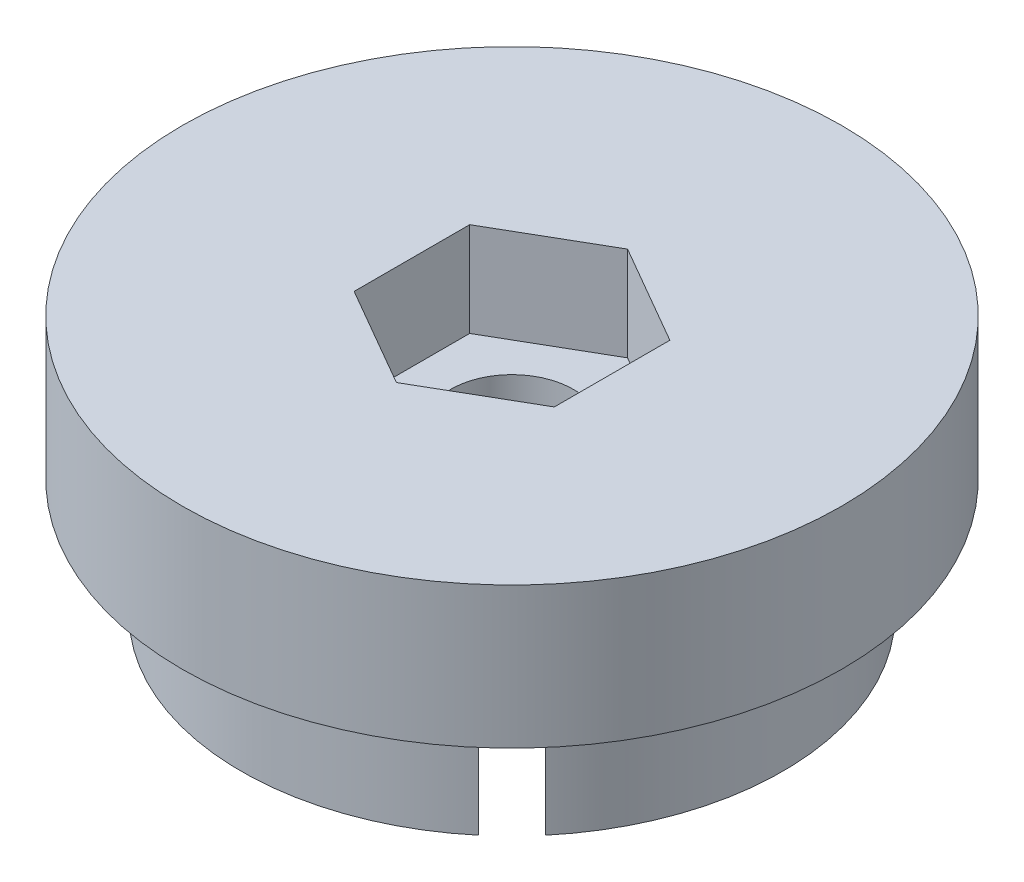
from build123d import *

# Parameters (mm, degrees)
SKETCH3_W           = 6
SKETCH3_H           = 6
SKETCH3_R           = 2.6
BASE_DEPTH          = 5
BLOC_START          = 6
SKETCH8_R           = 14
SKETCH8_R_2         = 2.6
BLOC_DEPTH          = 6
NUT_PLACE_DEPTH     = 4
REINFORCEMENT_DEPTH = 5


with BuildPart() as part:
    # Sketch3 → Base (new body)
    with BuildSketch(Plane(origin=(0, 0, 0), x_dir=(1, 0, 0), z_dir=(0, 1, 0))):
        Rectangle(SKETCH3_W, SKETCH3_H)
        with Locations(Location((0, 0, 0), (0, 0, 270))):
            Circle(SKETCH3_R, mode=Mode.SUBTRACT)
    extrude(amount=-BASE_DEPTH)

    # Sketch8 → Bloc (add)
    with BuildSketch(Plane(origin=(0, 0, 0), x_dir=(1, 0, 0), z_dir=(0, 1, 0)).offset(BLOC_START)):
        with Locations(Location((0, 0, 0), (0, 0, 270))):
            Circle(SKETCH8_R)
        with Locations(Location((0, 0, 0), (0, 0, 270))):
            Circle(SKETCH8_R_2, mode=Mode.SUBTRACT)
    extrude(amount=-BLOC_DEPTH)

    # Sketch4 → Nut_place (cut)
    with BuildSketch(Plane(origin=(0, 6, 0), x_dir=(1, 0, 0), z_dir=(0, 1, 0))):
        Polygon((0, 4.907477288), (-4.25, 2.453738644), (-4.25, -2.453738644), (0, -4.907477288), (4.25, -2.453738644), (4.25, 2.453738644), align=None)
    extrude(amount=-NUT_PLACE_DEPTH, mode=Mode.SUBTRACT)

    # Sketch9 → Reinforcement (add)
    with BuildSketch(Plane.XZ):
        with BuildLine():
            ThreePointArc((11.5, 0), (10.806071801, 3.934312168), (8.808032654, 7.393819092))
            Line((8.808032654, 7.393819092), (5.539213562, 4.125))
            Line((5.539213562, 4.125), (5.539213562, -4.125))
            Line((5.539213562, -4.125), (8.808032654, -7.393819092))
            ThreePointArc((8.808032654, -7.393819092), (10.806071801, -3.934312168), (11.5, 0))
        make_face()
        with BuildLine():
            Line((-4.125, -5.539213562), (-7.393819092, -8.808032654))
            ThreePointArc((-7.393819092, -8.808032654), (0, -11.5), (7.393819092, -8.808032654))
            Line((7.393819092, -8.808032654), (4.125, -5.539213562))
            Line((4.125, -5.539213562), (-4.125, -5.539213562))
        make_face()
        with BuildLine():
            Line((-5.539213562, -4.125), (-5.539213562, 4.125))
            Line((-5.539213562, 4.125), (-8.808032654, 7.393819092))
            ThreePointArc((-8.808032654, 7.393819092), (-11.5, 0), (-8.808032654, -7.393819092))
            Line((-8.808032654, -7.393819092), (-5.539213562, -4.125))
        make_face()
        with BuildLine():
            ThreePointArc((7.393819092, 8.808032654), (0, 11.5), (-7.393819092, 8.808032654))
            Line((-7.393819092, 8.808032654), (-4.125, 5.539213562))
            Line((-4.125, 5.539213562), (4.125, 5.539213562))
            Line((4.125, 5.539213562), (7.393819092, 8.808032654))
        make_face()
    extrude(amount=REINFORCEMENT_DEPTH)


solid = part.part
